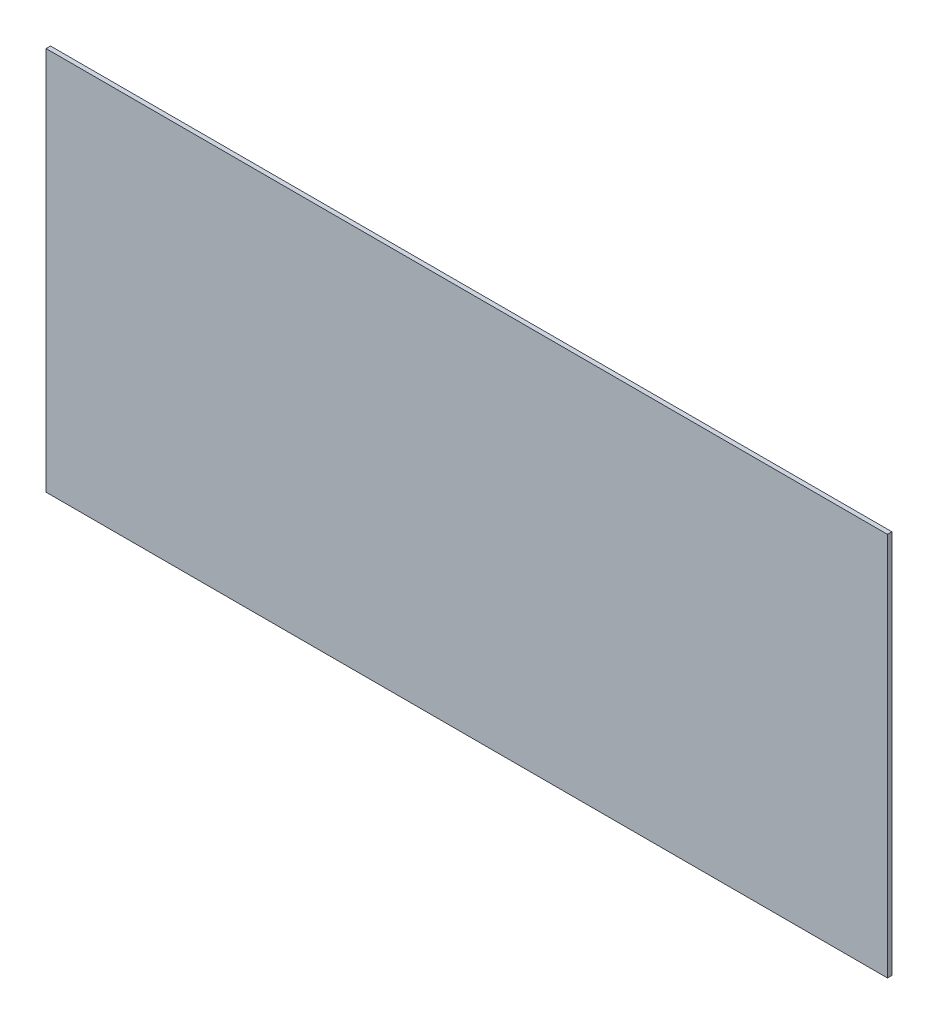
from build123d import *

# Parameters (mm, degrees)
SKETCH2_W           = 946
SKETCH2_H           = 432
BOSS_EXTRUDE1_DEPTH = 5


with BuildPart() as part:
    # Sketch2 → Boss-Extrude1 (new body)
    with BuildSketch(Plane.XY):
        with Locations((-201.680688337, 9.195028681)):
            Rectangle(SKETCH2_W, SKETCH2_H)
    extrude(amount=BOSS_EXTRUDE1_DEPTH)


solid = part.part
